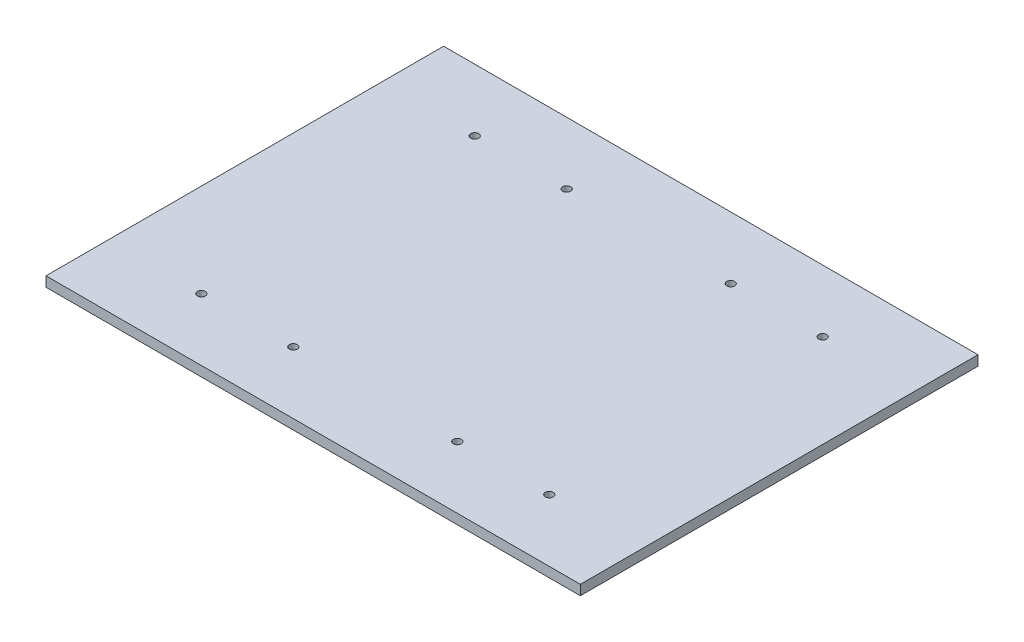
from build123d import *

# Parameters (mm, degrees)
SKETCH1_W                  = 215
SKETCH1_H                  = 160
BOSS_EXTRUDE1_DEPTH        = 4
F_1_0_3_2_DIAMETER_HOLE1_D = 3.2


with BuildPart() as part:
    # Sketch1 → Boss-Extrude1 (new body)
    with BuildSketch(Plane(origin=(0, 0, 0), x_dir=(1, 0, 0), z_dir=(0, 1, 0))):
        Rectangle(SKETCH1_W, SKETCH1_H)
    extrude(amount=BOSS_EXTRUDE1_DEPTH)

    # Ø1.0 (3.2) Diameter Hole1 (through all)
    with Locations(Plane.XZ):
        with Locations((-70, 55), (33, 55), (-33, 55), (70, 55), (70, -55), (33, -55), (-33, -55), (-70, -55)):
            Hole(F_1_0_3_2_DIAMETER_HOLE1_D / 2)


solid = part.part
